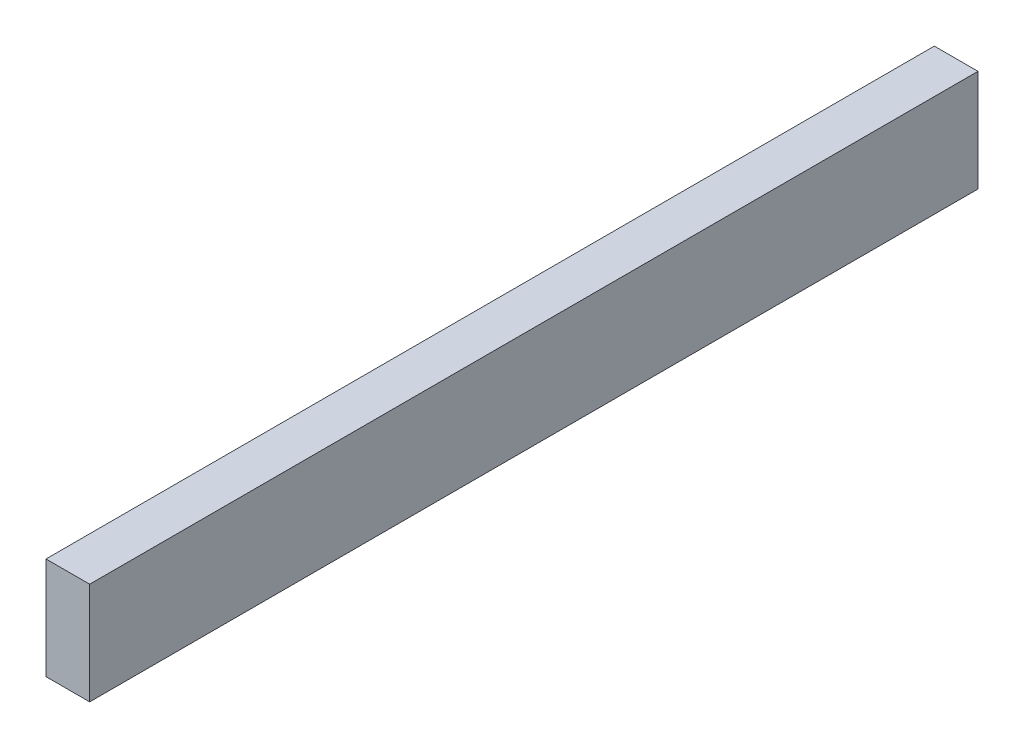
from build123d import *

# Parameters (mm, degrees)
SKETCH1_W           = 38.1
SKETCH1_H           = 88.9
BOSS_EXTRUDE1_DEPTH = 774.7


with BuildPart() as part:
    # Sketch1 → Boss-Extrude1 (new body)
    with BuildSketch(Plane.XY):
        with Locations((-458.25334595, -476.733106815)):
            Rectangle(SKETCH1_W, SKETCH1_H)
    extrude(amount=BOSS_EXTRUDE1_DEPTH)


solid = part.part
